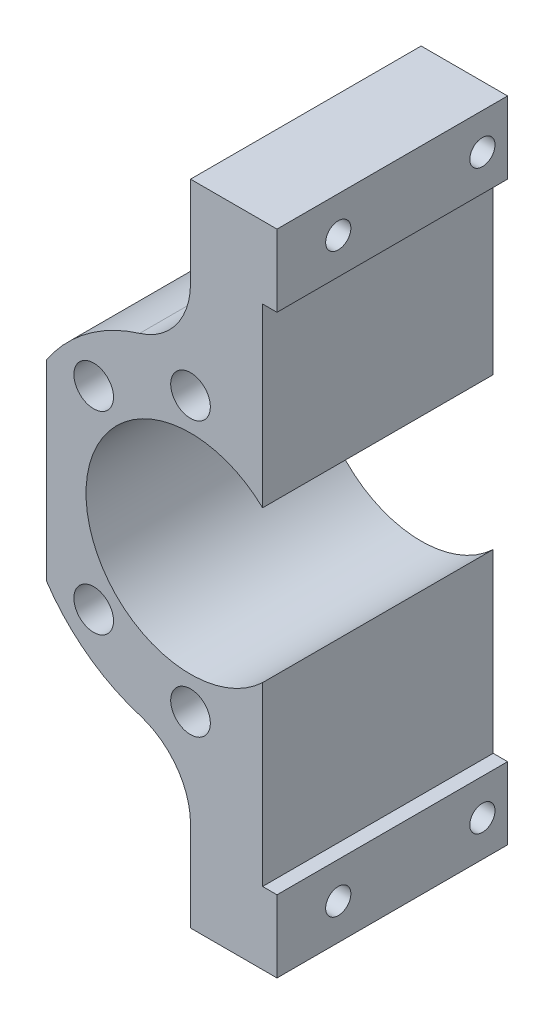
from build123d import *

# Parameters (mm, degrees)
ESQUISSE2_R        = 2.75
BOSS_EXTRU_1_DEPTH = 32
ESQUISSE3_W        = 32
ESQUISSE3_H        = 21
ESQUISSE3_R        = 1.75
BOSS_EXTRU_2_DEPTH = 10
BOSS_EXTRU_3_START = 2
ESQUISSE4_W        = 32
ESQUISSE4_H        = 10
ESQUISSE4_R        = 1.75
BOSS_EXTRU_3_DEPTH = 2
CONG_1_R           = 10


with BuildPart() as part:
    # Esquisse2 → Boss.-Extru.1 (new body)
    with BuildSketch(Plane.XY):
        with BuildLine():
            Line((-22.386521132, 12.057241029), (-22.386521132, -14.475757294))
            ThreePointArc((-22.386521132, -14.475757294), (-13.735618456, -22.356314427), (-2.386521132, -25.209258133))
            Line((-2.386521132, -25.209258133), (7.613478868, -25.209258133))
            Line((7.613478868, -25.209258133), (7.613478868, -11.709258133))
            ThreePointArc((7.613478868, -11.709258133), (-16.886521132, -1.209258133), (7.613478868, 9.290741867))
            Line((7.613478868, 9.290741867), (7.613478868, 22.790741867))
            Line((7.613478868, 22.790741867), (-2.386521132, 22.790741867))
            ThreePointArc((-2.386521132, 22.790741867), (-13.735618456, 19.937798162), (-22.386521132, 12.057241029))
        make_face()
        with Locations((-2.386521132, 17.790741867)):
            Circle(ESQUISSE2_R, mode=Mode.SUBTRACT)
        with Locations((-15.821549975, 12.22577071)):
            Circle(ESQUISSE2_R, mode=Mode.SUBTRACT)
        with Locations((-2.386521132, -20.209258133)):
            Circle(ESQUISSE2_R, mode=Mode.SUBTRACT)
        with Locations((-15.821549975, -14.644286975)):
            Circle(ESQUISSE2_R, mode=Mode.SUBTRACT)
    extrude(amount=BOSS_EXTRU_1_DEPTH)

    # Esquisse3 → Boss.-Extru.2 (add)
    # profile 1 of 2: a face of its own
    with BuildSketch(Plane(origin=(7.613478868, 0, 0), x_dir=(0, 0, -1), z_dir=(1, 0, 0))):
        with Locations((-16, 33.290741867)):
            Rectangle(ESQUISSE3_W, ESQUISSE3_H)
        with Locations(Location((-23.5, 38.790741867, 0), (0, 0, 90))):
            Circle(ESQUISSE3_R, mode=Mode.SUBTRACT)
        with Locations(Location((-3.5, 38.790741867, 0), (0, 0, 90))):
            Circle(ESQUISSE3_R, mode=Mode.SUBTRACT)
    # profile 2 of 2: a face of its own
    with BuildSketch(Plane(origin=(7.613478868, 0, 0), x_dir=(0, 0, -1), z_dir=(1, 0, 0))):
        with Locations((-16, -35.709258133)):
            Rectangle(ESQUISSE3_W, ESQUISSE3_H)
        with Locations(Location((-23.5, -41.209258133, 0), (0, 0, 90))):
            Circle(ESQUISSE3_R, mode=Mode.SUBTRACT)
        with Locations(Location((-3.5, -41.209258133, 0), (0, 0, 90))):
            Circle(ESQUISSE3_R, mode=Mode.SUBTRACT)
    extrude(amount=-BOSS_EXTRU_2_DEPTH)

    # Esquisse4 → Boss.-Extru.3 (add)
    # profile 1 of 2: a face of its own
    with BuildSketch(Plane(origin=(7.613478868, 0, 0), x_dir=(0, 0, -1), z_dir=(1, 0, 0)).offset(BOSS_EXTRU_3_START)):
        with Locations((-16, 38.790741867)):
            Rectangle(ESQUISSE4_W, ESQUISSE4_H)
        with Locations(Location((-3.5, 38.790741867, 0), (0, 0, 90))):
            Circle(ESQUISSE4_R, mode=Mode.SUBTRACT)
        with Locations(Location((-23.5, 38.790741867, 0), (0, 0, 90))):
            Circle(ESQUISSE4_R, mode=Mode.SUBTRACT)
    # profile 2 of 2: a face of its own
    with BuildSketch(Plane(origin=(7.613478868, 0, 0), x_dir=(0, 0, -1), z_dir=(1, 0, 0)).offset(BOSS_EXTRU_3_START)):
        with Locations((-16, -41.209258133)):
            Rectangle(ESQUISSE4_W, ESQUISSE4_H)
        with Locations(Location((-3.5, -41.209258133, 0), (0, 0, 90))):
            Circle(ESQUISSE4_R, mode=Mode.SUBTRACT)
        with Locations(Location((-23.5, -41.209258133, 0), (0, 0, 90))):
            Circle(ESQUISSE4_R, mode=Mode.SUBTRACT)
    extrude(amount=-BOSS_EXTRU_3_DEPTH)

    # Congé1
    cong_1_edges = [part.edges().sort_by_distance(p)[0] for p in [
        (-2.386521132, 22.790741867, 16),
        (-2.386521132, -25.209258133, 16),
    ]]
    fillet(cong_1_edges, radius=CONG_1_R)


solid = part.part
